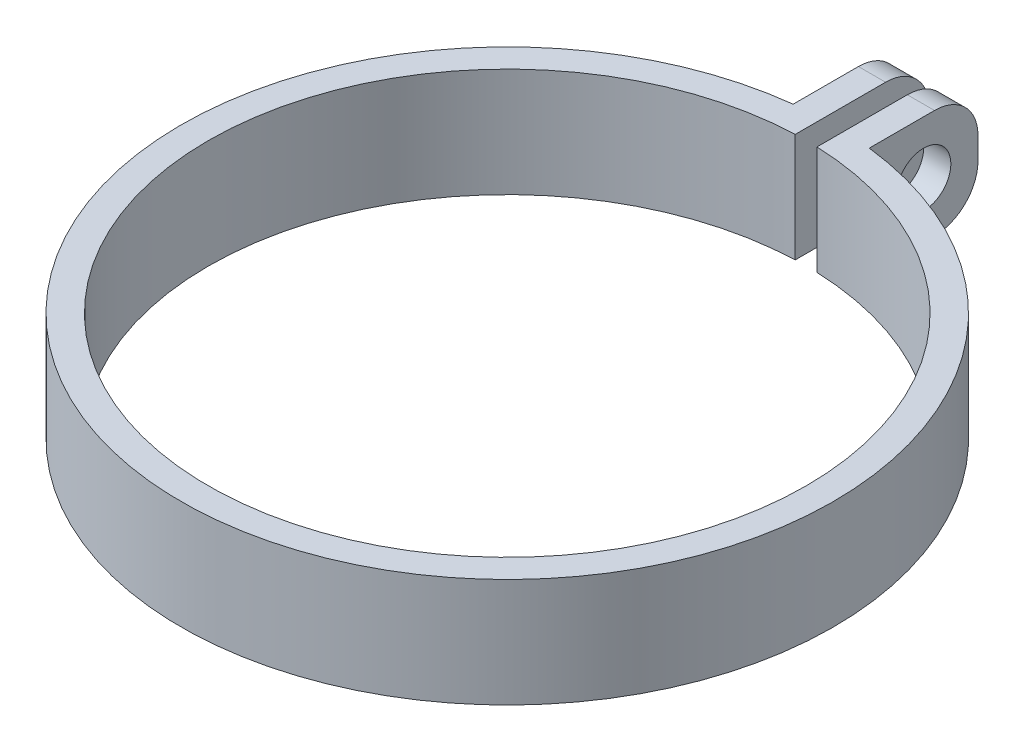
from build123d import *

# Parameters (mm, degrees)
SALIENTE_EXTRUIR1_DEPTH = 10
CROQUIS3_R              = 2.5
CORTAR_EXTRUIR1_DEPTH   = 10
REDONDEO1_R             = 4


with BuildPart() as part:
    # Croquis2 → Saliente-Extruir1 (new body)
    with BuildSketch(Plane(origin=(0, 0, 0), x_dir=(1, 0, 0), z_dir=(0, 1, 0))):
        with BuildLine():
            Line((-1, 39.795133831), (-1, 27.481812167))
            ThreePointArc((-1, 27.481812167), (0, -27.5), (1, 27.481812167))
            Line((1, 27.481812167), (1, 39.795133831))
            Line((1, 39.795133831), (3.5, 39.795133831))
            Line((3.5, 39.795133831), (3.5, 29.795133831))
            ThreePointArc((3.5, 29.795133831), (0, -30), (-3.5, 29.795133831))
            Line((-3.5, 29.795133831), (-3.5, 39.795133831))
            Line((-3.5, 39.795133831), (-1, 39.795133831))
        make_face()
    extrude(amount=SALIENTE_EXTRUIR1_DEPTH)

    # Croquis3 → Cortar-Extruir1 (cut)
    with BuildSketch(Plane.ZY.offset(3.5)):
        with Locations((-34.795133831, 5)):
            Circle(CROQUIS3_R)
    extrude(amount=-CORTAR_EXTRUIR1_DEPTH, mode=Mode.SUBTRACT)

    # Redondeo1
    redondeo1_edges = [part.edges().sort_by_distance(p)[0] for p in [
        (-2.25, 0, -39.795133831),
        (-2.25, 10, -39.795133831),
        (2.25, 10, -39.795133831),
        (2.25, 0, -39.795133831),
    ]]
    fillet(redondeo1_edges, radius=REDONDEO1_R)


solid = part.part
